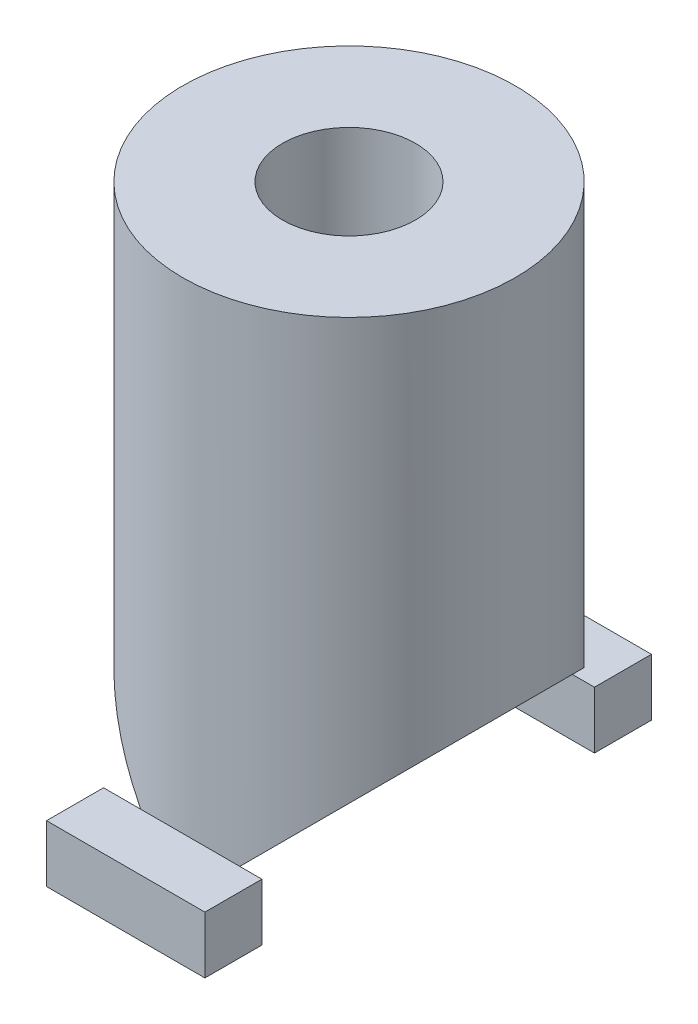
from build123d import *

# Parameters (mm, degrees)
SKETCH2_R                  = 5.25
BOSS_EXTRUDE1_DEPTH        = 17
SKETCH3_R                  = 2.1
CUT_EXTRUDE1_DEPTH         = 7
CUT_EXTRUDE3_DEPTH         = 7
CUT_EXTRUDE3_DEPTH_BACK    = 7
SKETCH4_R                  = 5.25
BOSS_EXTRUDE2_DEPTH        = 2.5
BOSS_EXTRUDE2_DEPTH_BACK   = 2.5
SKETCH5_W                  = 1.8
SKETCH5_H                  = 1.802095862
BOSS_EXTRUDE2_2_DEPTH      = 2.5
BOSS_EXTRUDE2_2_DEPTH_BACK = 2.5


with BuildPart() as part:
    # Sketch2 → Boss-Extrude1 (new body)
    with BuildSketch(Plane(origin=(0, 0, 0), x_dir=(1, 0, 0), z_dir=(0, 1, 0))):
        Circle(SKETCH2_R)
    extrude(amount=BOSS_EXTRUDE1_DEPTH)

    # Sketch3 → Cut-Extrude1 (cut)
    with BuildSketch(Plane(origin=(0, 17, 0), x_dir=(1, 0, 0), z_dir=(0, 1, 0))):
        Circle(SKETCH3_R)
    extrude(amount=-CUT_EXTRUDE1_DEPTH, mode=Mode.SUBTRACT)

    # Sketch4 → Cut-Extrude3 (cut, two sides: drawn at the far end of the back side and taken through both)
    with BuildSketch(Plane(origin=(0, 0, 0), x_dir=(0, 0, -1), z_dir=(1, 0, 0)).offset(-CUT_EXTRUDE3_DEPTH_BACK)):
        Circle(SKETCH4_R)
    extrude(amount=CUT_EXTRUDE3_DEPTH + CUT_EXTRUDE3_DEPTH_BACK, mode=Mode.SUBTRACT)


with BuildPart() as body_2:
    # Sketch5 → Boss-Extrude2 (new, two sides: drawn at the far end of the back side and taken through both)
    with BuildSketch(Plane(origin=(0, 0, 0), x_dir=(0, 0, -1), z_dir=(1, 0, 0)).offset(-BOSS_EXTRUDE2_DEPTH_BACK)):
        with Locations((6.15, 0.901047931)):
            Rectangle(SKETCH5_W, SKETCH5_H)
    extrude(amount=BOSS_EXTRUDE2_DEPTH + BOSS_EXTRUDE2_DEPTH_BACK)


with BuildPart() as body_3:
    # Sketch5 → Boss-Extrude2 2 (new, two sides: drawn at the far end of the back side and taken through both)
    with BuildSketch(Plane(origin=(0, 0, 0), x_dir=(0, 0, -1), z_dir=(1, 0, 0)).offset(-BOSS_EXTRUDE2_2_DEPTH_BACK)):
        with Locations((-6.15, 0.901047931)):
            Rectangle(SKETCH5_W, SKETCH5_H)
    extrude(amount=BOSS_EXTRUDE2_2_DEPTH + BOSS_EXTRUDE2_2_DEPTH_BACK)


solid = Compound([part.part, body_2.part, body_3.part])
